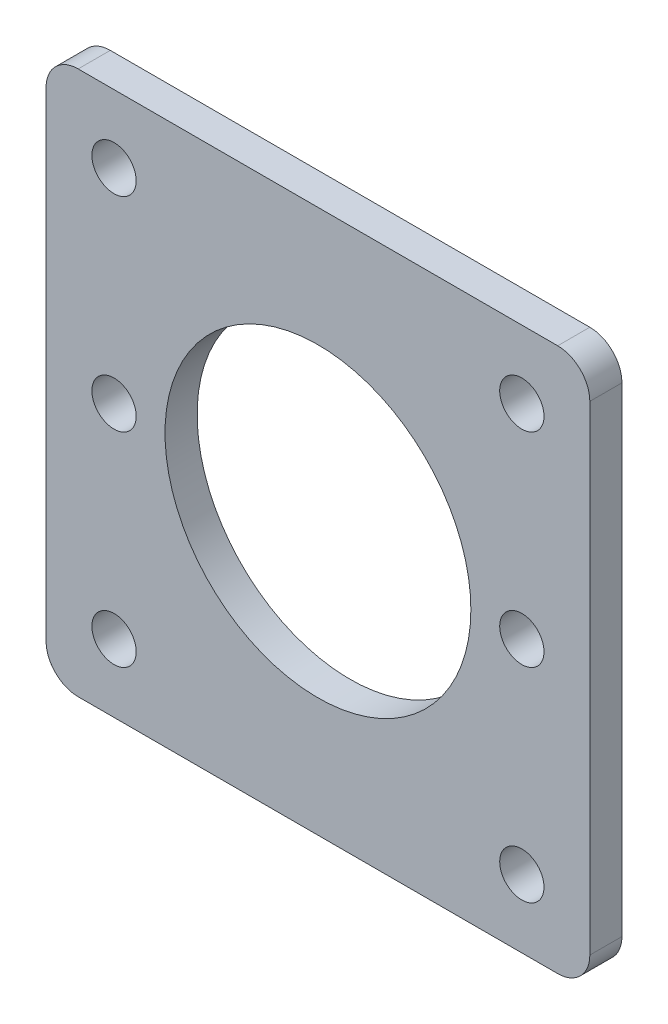
from build123d import *

# Parameters (mm, degrees)
SKETCH1_W           = 50.8
SKETCH1_H           = 50.8
SKETCH1_R           = 14.2875
SKETCH1_R_2         = 2.07
BOSS_EXTRUDE1_DEPTH = 1.5
FILLET1_R           = 3


with BuildPart() as part:
    # Sketch1 → Boss-Extrude1 (new, symmetric)
    with BuildSketch(Plane.XY):
        Rectangle(SKETCH1_W, SKETCH1_H)
        Circle(SKETCH1_R, mode=Mode.SUBTRACT)
        with Locations((-19.05, 19.05)):
            Circle(SKETCH1_R_2, mode=Mode.SUBTRACT)
        with Locations(Location((19.05, -19.05, 0), (0, 0, 180))):
            Circle(SKETCH1_R_2, mode=Mode.SUBTRACT)
        with Locations((19.05, 19.05)):
            Circle(SKETCH1_R_2, mode=Mode.SUBTRACT)
        with Locations((-19.05, -19.05)):
            Circle(SKETCH1_R_2, mode=Mode.SUBTRACT)
        with Locations((-19.05, 0)):
            Circle(SKETCH1_R_2, mode=Mode.SUBTRACT)
        with Locations(Location((19.05, 0, 0), (0, 0, 180))):
            Circle(SKETCH1_R_2, mode=Mode.SUBTRACT)
    extrude(amount=BOSS_EXTRUDE1_DEPTH, both=True)

    # Fillet1
    fillet1_edges = [part.edges().sort_by_distance(p)[0] for p in [
        (25.4, -25.4, 0),
        (-25.4, -25.4, 0),
        (-25.4, 25.4, 0),
        (25.4, 25.4, 0),
    ]]
    fillet(fillet1_edges, radius=FILLET1_R)


solid = part.part
